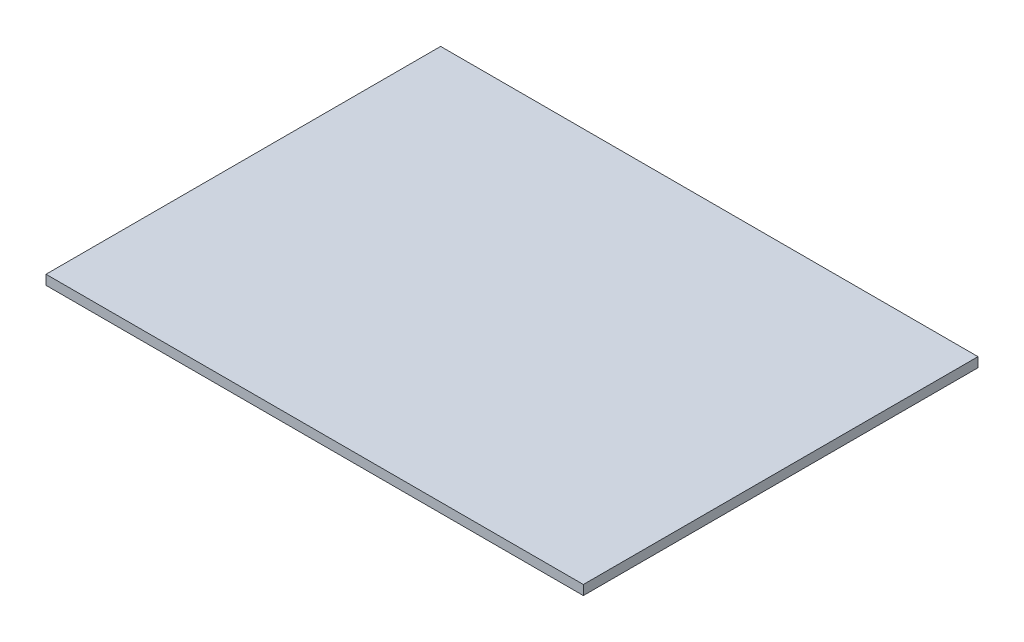
from build123d import *

# Parameters (mm, degrees)
SKETCH1_W           = 141.694249464
SKETCH1_H           = 104.060899654
BOSS_EXTRUDE1_DEPTH = 2.54


with BuildPart() as part:
    # Sketch1 → Boss-Extrude1 (new body)
    with BuildSketch(Plane(origin=(0, 0, 0), x_dir=(1, 0, 0), z_dir=(0, 1, 0))):
        with Locations((-70.847124732, 52.030449827)):
            Rectangle(SKETCH1_W, SKETCH1_H)
    extrude(amount=BOSS_EXTRUDE1_DEPTH)


solid = part.part
